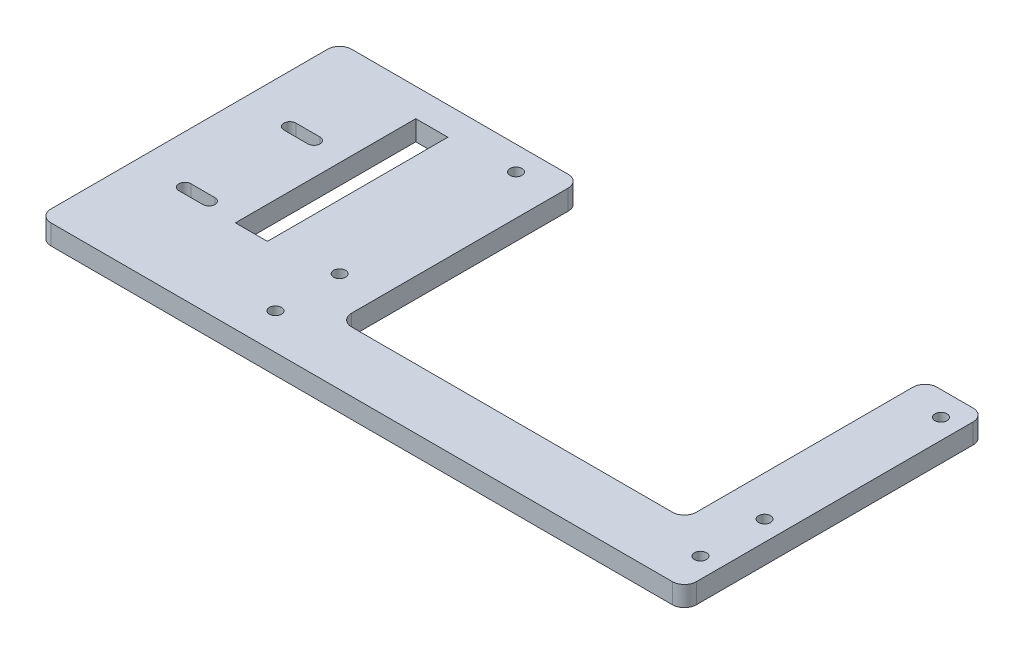
from build123d import *

# Parameters (mm, degrees)
SKETCH_1_R          = 1.5
EXTRUDE_1_DEPTH     = 5
SKETCH_11_W         = 8
SKETCH_11_H         = 45
CUT_EXTRUDE_6_DEPTH = 118.584012519
FILLET_1_R          = 3
CUT_EXTRUDE_7_DEPTH = 118.584012519


with BuildPart() as part:
    # 草图1 → 凸台-拉伸1 (new body)
    with BuildSketch(Plane(origin=(0, 0, 0), x_dir=(1, 0, 0), z_dir=(0, 1, 0))):
        Polygon((0, 0), (0, 60), (-60, 60), (-60, -15), (101, -15), (101, 60), (86, 60), (86, 0), align=None)
        with Locations(Location((-10, 54, 0), (0, 0, 270))):
            Circle(SKETCH_1_R, mode=Mode.SUBTRACT)
        with Locations(Location((-10, -6, 0), (0, 0, 90))):
            Circle(SKETCH_1_R, mode=Mode.SUBTRACT)
        with Locations(Location((96, 54, 0), (0, 0, 270))):
            Circle(SKETCH_1_R, mode=Mode.SUBTRACT)
        with Locations(Location((96, -6, 0), (0, 0, 270))):
            Circle(SKETCH_1_R, mode=Mode.SUBTRACT)
        with Locations(Location((96, 10, 0), (0, 0, 270))):
            Circle(SKETCH_1_R, mode=Mode.SUBTRACT)
        with Locations(Location((-10, 10, 0), (0, 0, 90))):
            Circle(SKETCH_1_R, mode=Mode.SUBTRACT)
    extrude(amount=EXTRUDE_1_DEPTH)

    # 草图11 → 切除-拉伸6 (cut, through all)
    with BuildSketch(Plane(origin=(0, 5, 0), x_dir=(1, 0, 0), z_dir=(0, 1, 0))):
        with Locations((-30, 30.5)):
            Rectangle(SKETCH_11_W, SKETCH_11_H)
    extrude(amount=-CUT_EXTRUDE_6_DEPTH, mode=Mode.SUBTRACT)

    # 圆角1
    fillet_1_edges = [part.edges().sort_by_distance(p)[0] for p in [
        (86, 2.5, 0),
        (86, 2.5, -60),
        (101, 2.5, -60),
        (101, 2.5, 15),
        (-60, 2.5, 15),
        (-60, 2.5, -60),
        (0, 2.5, -60),
        (0, 2.5, 0),
    ]]
    fillet(fillet_1_edges, radius=FILLET_1_R)

    # 草图12 → 切除-拉伸7 (cut, through all)
    with BuildSketch(Plane(origin=(0, 5, 0), x_dir=(1, 0, 0), z_dir=(0, 1, 0))):
        with BuildLine():
            Line((-48, 37.1), (-42, 37.1))
            ThreePointArc((-42, 37.1), (-40.5, 35.6), (-42, 34.1))
            Line((-42, 34.1), (-48, 34.1))
            ThreePointArc((-48, 34.1), (-49.5, 35.6), (-48, 37.1))
        make_face()
        with BuildLine():
            Line((-48, 7.9), (-42, 7.9))
            ThreePointArc((-42, 7.9), (-40.5, 9.4), (-42, 10.9))
            Line((-42, 10.9), (-48, 10.9))
            ThreePointArc((-48, 10.9), (-49.5, 9.4), (-48, 7.9))
        make_face()
    extrude(amount=-CUT_EXTRUDE_7_DEPTH, mode=Mode.SUBTRACT)


solid = part.part
